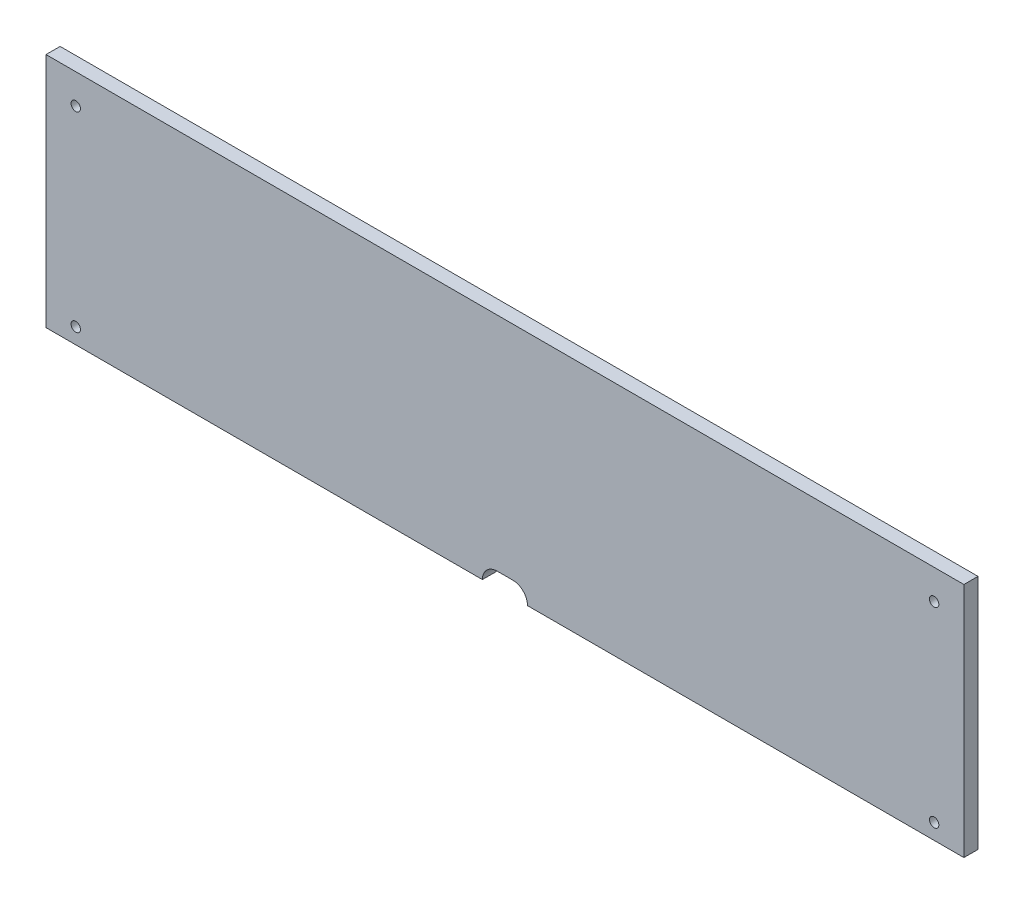
from build123d import *

# Parameters (mm, degrees)
SKETCH1_W           = 293
SKETCH1_H           = 75.5
BOSS_EXTRUDE1_DEPTH = 4.5
CUT_EXTRUDE1_REACH  = 153.352
SKETCH2_R           = 1.5


with BuildPart() as part:
    # Sketch1 → Boss-Extrude1 (new body)
    with BuildSketch(Plane.XY):
        Rectangle(SKETCH1_W, SKETCH1_H)
    extrude(amount=BOSS_EXTRUDE1_DEPTH)

    # Sketch2 → Cut-Extrude1 (cut, up to next)
    with BuildSketch(Plane.XY.offset(4.5), mode=Mode.PRIVATE) as cut_extrude1_sk1:
        with Locations((137, 28.25)):
            Circle(SKETCH2_R)
    cut_extrude1_tool1 = extrude(cut_extrude1_sk1.sketch, amount=-CUT_EXTRUDE1_REACH, mode=Mode.PRIVATE) & part.part
    # Sketch2 → Cut-Extrude1 (cut, up to next)
    with BuildSketch(Plane.XY.offset(4.5), mode=Mode.PRIVATE) as cut_extrude1_sk2:
        with Locations((-137, 28.25)):
            Circle(SKETCH2_R)
    cut_extrude1_tool2 = extrude(cut_extrude1_sk2.sketch, amount=-CUT_EXTRUDE1_REACH, mode=Mode.PRIVATE) & part.part
    # Sketch2 → Cut-Extrude1 (cut, up to next)
    with BuildSketch(Plane.XY.offset(4.5), mode=Mode.PRIVATE) as cut_extrude1_sk3:
        with Locations((-137, -32.75)):
            Circle(SKETCH2_R)
    cut_extrude1_tool3 = extrude(cut_extrude1_sk3.sketch, amount=-CUT_EXTRUDE1_REACH, mode=Mode.PRIVATE) & part.part
    # Sketch2 → Cut-Extrude1 (cut, up to next)
    with BuildSketch(Plane.XY.offset(4.5), mode=Mode.PRIVATE) as cut_extrude1_sk4:
        with Locations((137, -32.75)):
            Circle(SKETCH2_R)
    cut_extrude1_tool4 = extrude(cut_extrude1_sk4.sketch, amount=-CUT_EXTRUDE1_REACH, mode=Mode.PRIVATE) & part.part
    # Sketch2 → Cut-Extrude1 (cut, up to next)
    with BuildSketch(Plane.XY.offset(4.5), mode=Mode.PRIVATE) as cut_extrude1_sk5:
        with BuildLine():
            Line((2.5, -42.449938401), (-2.5, -42.449938401))
            ThreePointArc((-2.5, -42.449938401), (-7.199938401, -37.75), (-2.5, -33.050061599))
            Line((-2.5, -33.050061599), (2.5, -33.050061599))
            ThreePointArc((2.5, -33.050061599), (7.199938401, -37.75), (2.5, -42.449938401))
        make_face()
    cut_extrude1_tool5 = extrude(cut_extrude1_sk5.sketch, amount=-CUT_EXTRUDE1_REACH, mode=Mode.PRIVATE) & part.part
    add(cut_extrude1_tool1.solids().sort_by_distance((137, 28.25, 4.5))[0], mode=Mode.SUBTRACT)
    add(cut_extrude1_tool2.solids().sort_by_distance((-137, 28.25, 4.5))[0], mode=Mode.SUBTRACT)
    add(cut_extrude1_tool3.solids().sort_by_distance((-137, -32.75, 4.5))[0], mode=Mode.SUBTRACT)
    add(cut_extrude1_tool4.solids().sort_by_distance((137, -32.75, 4.5))[0], mode=Mode.SUBTRACT)
    add(cut_extrude1_tool5.solids().sort_by_distance((0, -37.75, 4.5))[0], mode=Mode.SUBTRACT)


solid = part.part
